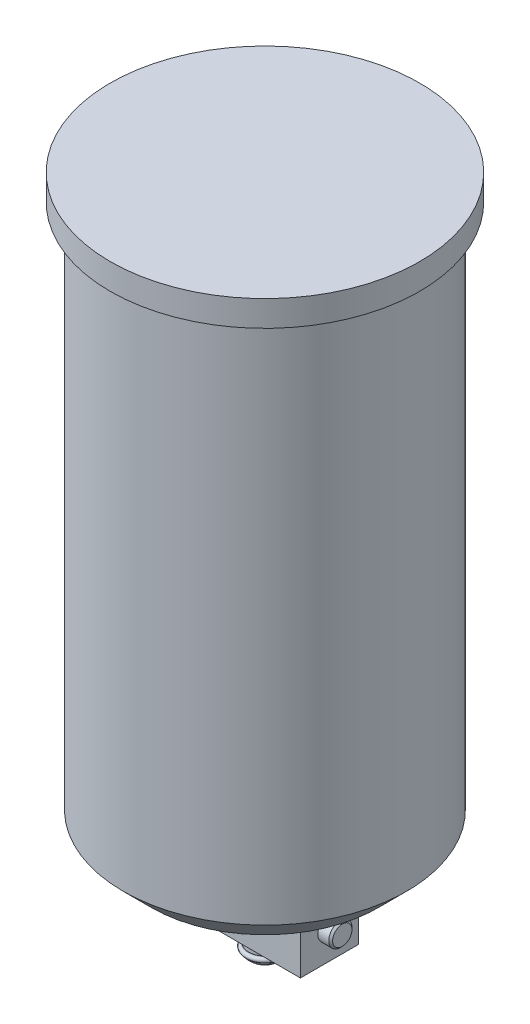
from build123d import *

# Parameters (mm, degrees)
SKETCH_2_W      = 20
SKETCH_2_H      = 9
EXTRUDE_1_DEPTH = 11
SKETCH_3_W      = 20
SKETCH_3_H      = 11
EXTRUDE_2_DEPTH = 2


with BuildPart() as part:
    # 草图1 → 旋转1 (revolve)
    with BuildSketch(Plane.XY):
        Polygon((0, 90), (24, 90), (24, 86), (22, 86), (22, 4.4), (17.6, 0), (0, 0), align=None)
    revolve(axis=Axis((0, 0, 0), (0, 1, 0)))

    # 草图2 → 凸台-拉伸1 (add)
    with BuildSketch(Plane(origin=(0, 0, 0), x_dir=(1, 0, 0), z_dir=(0, 1, 0))):
        Rectangle(SKETCH_2_W, SKETCH_2_H)
    extrude(amount=-EXTRUDE_1_DEPTH)

    # 草图3 → 凸台-拉伸2 (add)
    with BuildSketch(Plane(origin=(0, 0, 0), x_dir=(1, 0, 0), z_dir=(0, 1, 0))):
        Rectangle(SKETCH_3_W, SKETCH_3_H)
    extrude(amount=-EXTRUDE_2_DEPTH)

    # 草图4 → 旋转2 (revolve)
    with BuildSketch(Plane.XY):
        with BuildLine():
            Line((0, -11), (2.5, -11))
            Line((2.5, -11), (2.5, -13.533333333))
            Line((2.5, -13.533333333), (2.6, -13.533333333))
            ThreePointArc((2.6, -13.533333333), (2.882842712, -13.650490621), (3, -13.933333333))
            ThreePointArc((3, -13.933333333), (2.882842712, -14.216176046), (2.6, -14.333333333))
            Line((2.6, -14.333333333), (2.5, -14.333333333))
            Line((2.5, -14.333333333), (2.5, -14.666666667))
            Line((2.5, -14.666666667), (2.142857143, -14.666666667))
            Line((2.142857143, -14.666666667), (2.142857143, -15))
            Line((2.142857143, -15), (0, -15))
            Line((0, -15), (0, -11))
        make_face()
    revolve(axis=Axis((0, -15, 0), (0, 1, 0)))

    # 草图5 → 旋转3 (revolve)
    with BuildSketch(Plane.XY):
        Polygon((-11, -6.5), (-11, -5.825), (-10.775, -5.6), (9.5, -5.6), (9.5, -4.7), (11.7, -4.7), (12, -5), (12, -6.5), align=None)
    revolve(axis=Axis((12, -6.5, 0), (-1, 0, 0)))


solid = part.part
